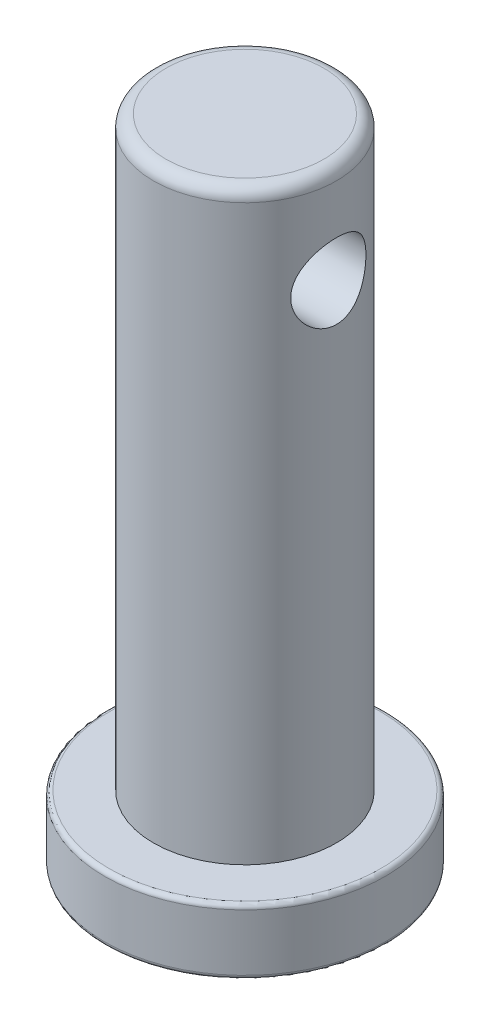
from build123d import *

# Parameters (mm, degrees)
SKETCH1_R               = 7.112
BOSS_EXTRUDE1_DEPTH     = 33.02
SKETCH2_OUTSIDE_W       = 23.956
SKETCH2_OUTSIDE_H       = 23.956
SKETCH2_OUTSIDE_R       = 4.6355
CUT_EXTRUDE1_DEPTH      = 29.6926
CUT_EXTRUDE2_DEPTH      = 35.517843038
CUT_EXTRUDE2_DEPTH_BACK = 35.517843038
SKETCH3_R               = 1.905
BOSS_EXTRUDE2_DEPTH     = 0.254
FILLET1_R               = 0.2286
FILLET2_R               = 0.635


with BuildPart() as part:
    # Sketch1 → Boss-Extrude1 (new body)
    with BuildSketch(Plane(origin=(0, 0, 0), x_dir=(1, 0, 0), z_dir=(0, 1, 0))):
        with Locations(Location((0, 0, 0), (0, 0, 270))):
            Circle(SKETCH1_R)
    extrude(amount=BOSS_EXTRUDE1_DEPTH)

    # Sketch2 outside → Cut-Extrude1 (cut)
    with BuildSketch(Plane(origin=(0, 33.02, 0), x_dir=(1, 0, 0), z_dir=(0, 1, 0))):
        Rectangle(SKETCH2_OUTSIDE_W, SKETCH2_OUTSIDE_H)
        with Locations(Location((0, 0, 0), (0, 0, 270))):
            Circle(SKETCH2_OUTSIDE_R, mode=Mode.SUBTRACT)
    extrude(amount=-CUT_EXTRUDE1_DEPTH, mode=Mode.SUBTRACT)

    # Sketch3 → Cut-Extrude2 (cut, two sides: drawn at the far end of the back side and taken through both)
    with BuildSketch(Plane(origin=(0, 0, 0), x_dir=(0, 0, -1), z_dir=(1, 0, 0)).offset(-CUT_EXTRUDE2_DEPTH_BACK)):
        with Locations((0, 27.9908)):
            Circle(SKETCH3_R)
    extrude(amount=CUT_EXTRUDE2_DEPTH + CUT_EXTRUDE2_DEPTH_BACK, mode=Mode.SUBTRACT)

    # Sketch4 → Boss-Extrude2 (add)
    # profile 1 of 2: a face of its own
    with BuildSketch(Plane.XZ):
        Polygon((-1.505619488, 2.477183377), (0.109765127, -1.022816623), (-0.231681187, -1.022816623), (-0.749109071, 0.098978249), (-2.335747693, 0.098978249), (-2.867899135, -1.022816623), (-3.210747693, -1.022816623), (-1.550491283, 2.477183377), align=None)
        Polygon((-1.531560994, 1.794991871), (-2.165375097, 0.457952608), (-0.914573815, 0.457952608), align=None, mode=Mode.SUBTRACT)
    # profile 2 of 2: a face of its own
    with BuildSketch(Plane.XZ):
        Polygon((0.737970256, 2.477183377), (2.443098461, 2.477183377), (2.443098461, 2.118209018), (1.05207282, 2.118209018), (1.05207282, 1.041285942), (2.443098461, 1.041285942), (2.443098461, 0.682311583), (1.05207282, 0.682311583), (1.05207282, -1.022816623), (0.737970256, -1.022816623), align=None)
    extrude(amount=BOSS_EXTRUDE2_DEPTH)

    # Fillet1
    fillet1_edges = [part.edges().sort_by_distance(p)[0] for p in [
        (0, 0, -7.112),
        (0, 3.3274, -7.112),
    ]]
    fillet(fillet1_edges, radius=FILLET1_R)

    # Fillet2
    fillet2_edges = [part.edges().sort_by_distance(p)[0] for p in [
        (0, 33.02, -4.6355),
    ]]
    fillet(fillet2_edges, radius=FILLET2_R)


solid = part.part
